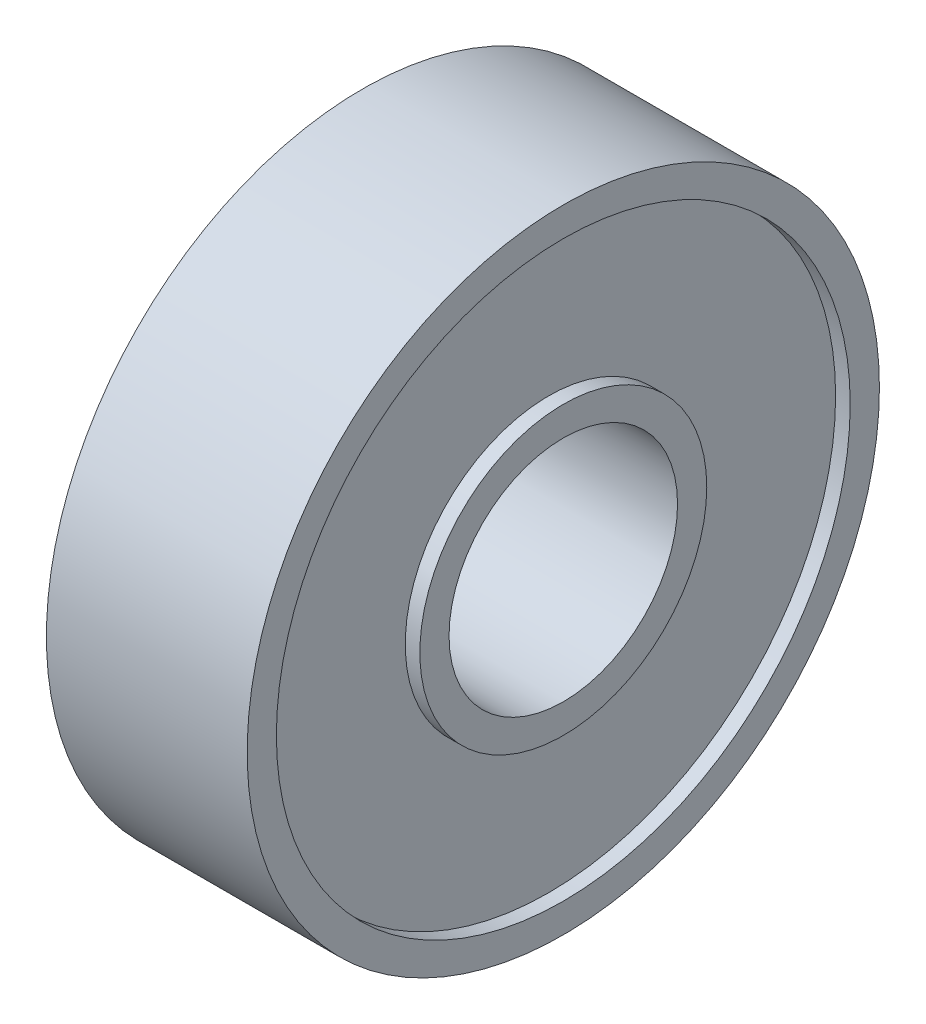
from build123d import *

# Parameters (mm, degrees)
SKETCH1_R      = 10.9982
SKETCH1_R_2    = 3.9751
EXTRUDE1_DEPTH = 3.4925
SKETCH2_R      = 9.9822
SKETCH2_R_2    = 4.9911
EXTRUDE2_DEPTH = 0.508


with BuildPart() as part:
    # Sketch1 → Extrude1 (new body)
    with BuildSketch(Plane(origin=(0, 0, 0), x_dir=(0, 0, -1), z_dir=(1, 0, 0))):
        Circle(SKETCH1_R)
        Circle(SKETCH1_R_2, mode=Mode.SUBTRACT)
    extrude1 = extrude(amount=EXTRUDE1_DEPTH)

    # Sketch2 → Extrude2 (cut)
    with BuildSketch(Plane(origin=(3.4925, 0, 0), x_dir=(0, 0, -1), z_dir=(1, 0, 0))):
        Circle(SKETCH2_R)
        Circle(SKETCH2_R_2, mode=Mode.SUBTRACT)
    extrude2 = extrude(amount=-EXTRUDE2_DEPTH, mode=Mode.SUBTRACT)

    # Mirror1: Extrude1, Extrude2 across plane
    add(extrude1.mirror(Plane(origin=(0, 0, 0), x_dir=(0, 0, 1), z_dir=(1, 0, 0))))
    add(extrude2.mirror(Plane(origin=(0, 0, 0), x_dir=(0, 0, 1), z_dir=(1, 0, 0))), mode=Mode.SUBTRACT)


solid = part.part
